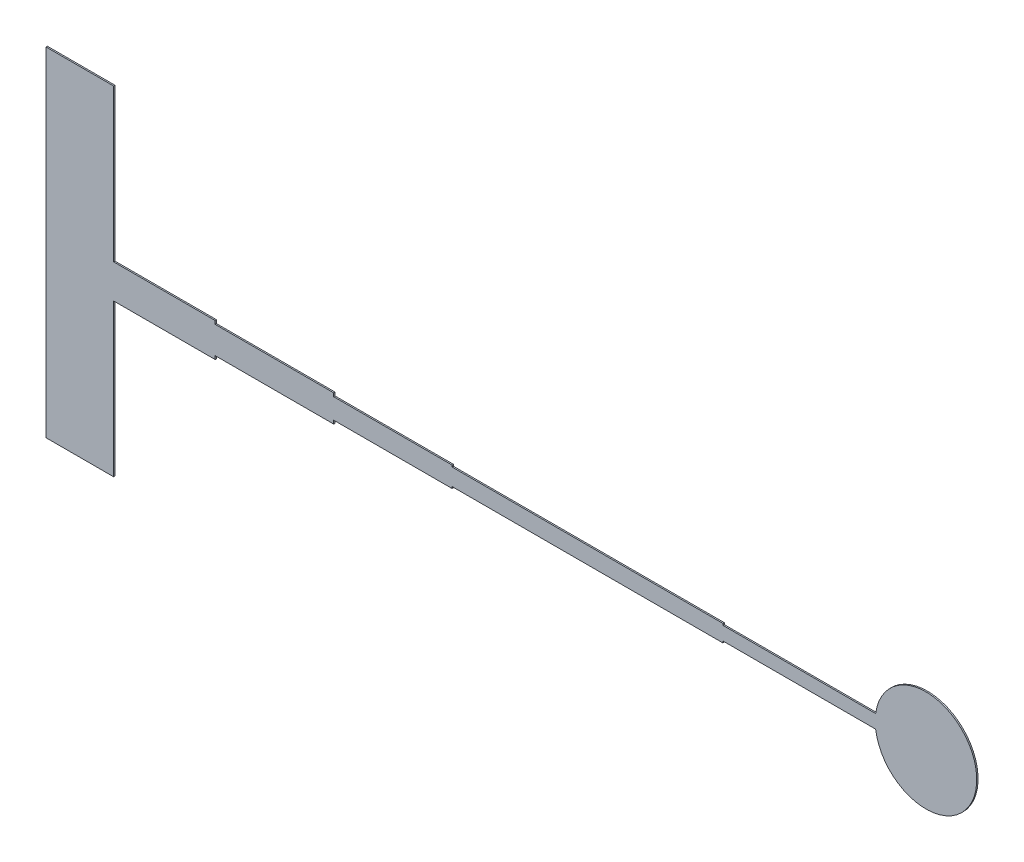
from build123d import *

# Parameters (mm, degrees)
BOSS_EXTRUDE1_DEPTH = 20
SKETCH2_W           = 1000
SKETCH2_H           = 2250
CUT_EXTRUDE1_DEPTH  = 12993.801853334
CUT_EXTRUDE4_DEPTH  = 12993.801853334


with BuildPart() as part:
    # Sketch1 → Boss-Extrude1 (new body)
    with BuildSketch(Plane.XY):
        with BuildLine():
            Line((1000, 250), (5000, 250))
            Line((5000, 250), (5000, 125))
            Line((5000, 125), (9000, 125))
            Line((9000, 125), (9000, 100))
            Line((9000, 100), (11256.696562634, 100))
            ThreePointArc((11256.696562634, 100), (12750, 0), (11256.696562634, -100))
            Line((11256.696562634, -100), (9000, -100))
            Line((9000, -100), (9000, -125))
            Line((9000, -125), (5000, -125))
            Line((5000, -125), (5000, -250))
            Line((5000, -250), (1000, -250))
            Line((1000, -250), (1000, -2500))
            Line((1000, -2500), (-1000, -2500))
            Line((-1000, -2500), (-1000, 2500))
            Line((-1000, 2500), (1000, 2500))
            Line((1000, 2500), (1000, 250))
        make_face()
    extrude(amount=-BOSS_EXTRUDE1_DEPTH)

    # Sketch2 → Cut-Extrude1 (cut, through all)
    with BuildSketch(Plane.XY):
        with Locations((500, 1375)):
            Rectangle(SKETCH2_W, SKETCH2_H)
        with Locations((500, -1375)):
            Rectangle(SKETCH2_W, SKETCH2_H)
    extrude(amount=-CUT_EXTRUDE1_DEPTH, mode=Mode.SUBTRACT)

    # Sketch3 → Cut-Extrude4 (cut, through all)
    with BuildSketch(Plane.XY):
        Polygon((1500, -250), (3250, -250), (5000, -250), (5000, -150), (3250, -150), (3250, -200), (1500, -200), align=None)
    cut_extrude4 = extrude(amount=-CUT_EXTRUDE4_DEPTH, mode=Mode.SUBTRACT)

    # Mirror1: Cut-Extrude4 across plane
    add(cut_extrude4.mirror(Plane.ZX), mode=Mode.SUBTRACT)


solid = part.part
